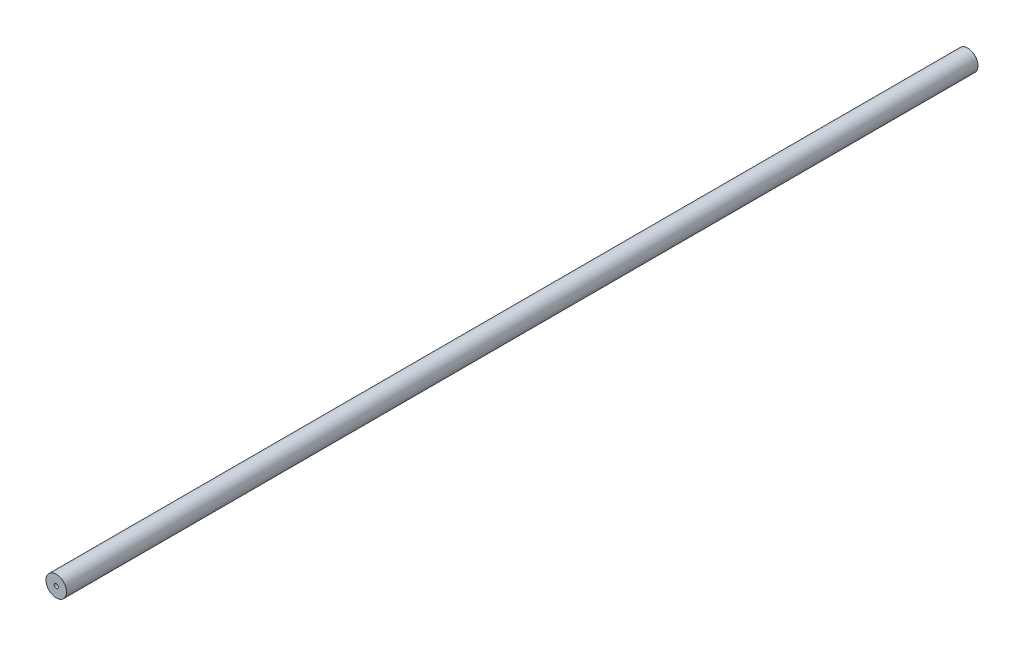
from build123d import *

# Parameters (mm, degrees)
SKETCH2_R           = 5.588
BOSS_EXTRUDE1_DEPTH = 247.65
SKETCH7_R           = 1.143
CUT_EXTRUDE3_DEPTH  = 25.4
CUT_EXTRUDE4_START  = -25.4
SKETCH9_R           = 1.143
CUT_EXTRUDE4_DEPTH  = 25.4


with BuildPart() as part:
    # Sketch2 → Boss-Extrude1 (new, symmetric)
    with BuildSketch(Plane.XY):
        Circle(SKETCH2_R)
    extrude(amount=BOSS_EXTRUDE1_DEPTH, both=True)

    # Sketch7 → Cut-Extrude3 (cut)
    with BuildSketch(Plane.XY.offset(247.65)):
        Circle(SKETCH7_R)
    extrude(amount=-CUT_EXTRUDE3_DEPTH, mode=Mode.SUBTRACT)

    # Sketch9 → Cut-Extrude4 (cut)
    with BuildSketch(Plane(origin=(0, 0, -247.65), x_dir=(-1, 0, 0), z_dir=(0, 0, -1)).offset(CUT_EXTRUDE4_START)):
        with Locations(Location((0, 0, 0), (0, 0, 180))):
            Circle(SKETCH9_R)
    extrude(amount=CUT_EXTRUDE4_DEPTH, mode=Mode.SUBTRACT)


solid = part.part
